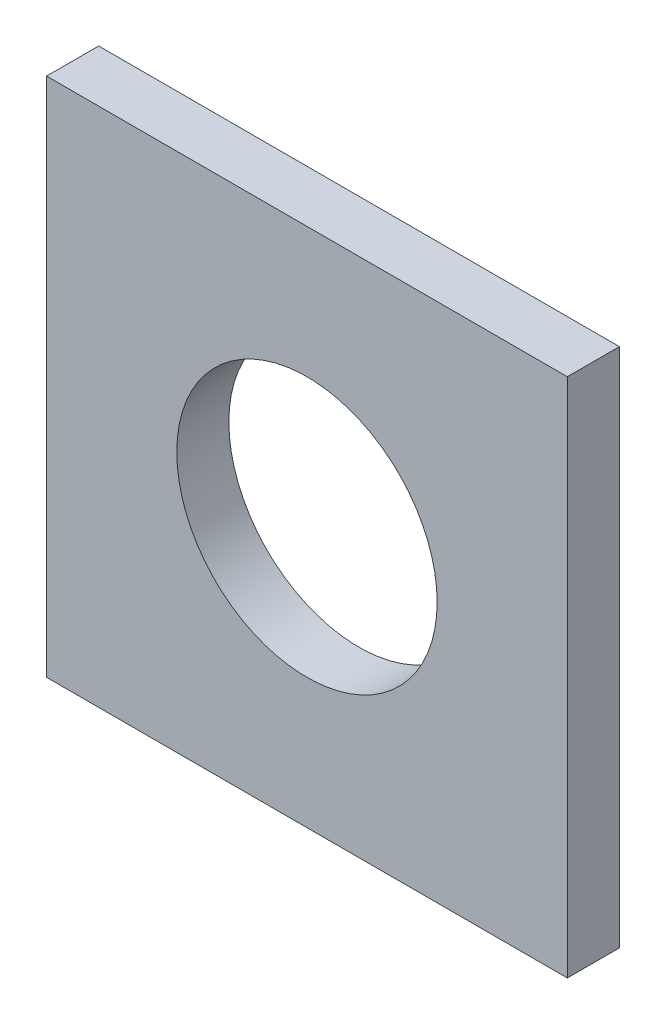
from build123d import *

# Parameters (mm, degrees)
SKETCH1_W           = 100
SKETCH1_H           = 100
BOSS_EXTRUDE1_DEPTH = 10
SKETCH2_R           = 25
CUT_EXTRUDE1_DEPTH  = 10


with BuildPart() as part:
    # Sketch1 → Boss-Extrude1 (new body)
    with BuildSketch(Plane.XY):
        Rectangle(SKETCH1_W, SKETCH1_H)
    extrude(amount=BOSS_EXTRUDE1_DEPTH)

    # Sketch2 → Cut-Extrude1 (cut)
    with BuildSketch(Plane.XY.offset(10)):
        Circle(SKETCH2_R)
    extrude(amount=-CUT_EXTRUDE1_DEPTH, mode=Mode.SUBTRACT)


solid = part.part
